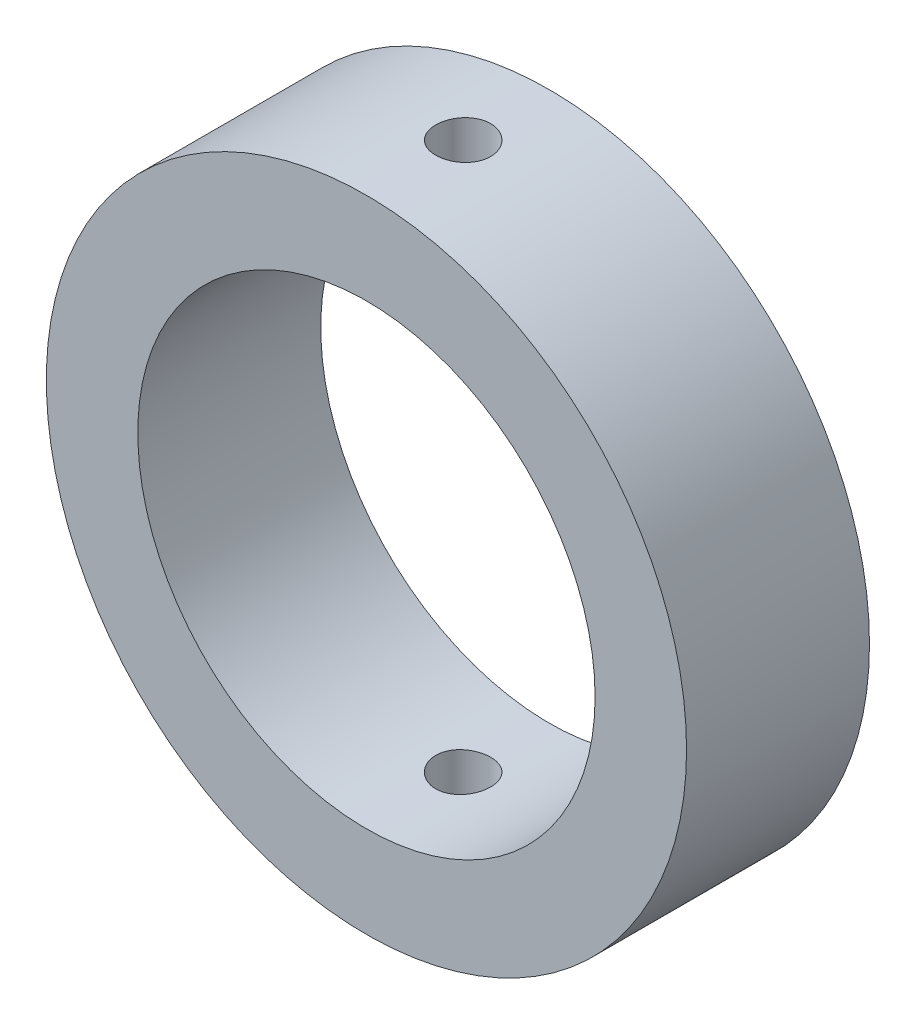
from build123d import *

# Parameters (mm, degrees)
SKETCH1_R               = 35
SKETCH1_R_2             = 25
BOSS_EXTRUDE1_DEPTH     = 20
CUT_EXTRUDE1_DEPTH      = 42
CUT_EXTRUDE1_DEPTH_BACK = 54.38539126
SKETCH2_R               = 3


with BuildPart() as part:
    # Sketch1 → Boss-Extrude1 (new body)
    with BuildSketch(Plane.XY):
        Circle(SKETCH1_R)
        Circle(SKETCH1_R_2, mode=Mode.SUBTRACT)
    extrude(amount=BOSS_EXTRUDE1_DEPTH)

    # Sketch2 → Cut-Extrude1 (cut, two sides: drawn at the far end of the back side and taken through both)
    with BuildSketch(Plane(origin=(0, 0, 0), x_dir=(1, 0, 0), z_dir=(0, 1, 0)).offset(-CUT_EXTRUDE1_DEPTH_BACK)):
        with Locations((0, -9.424155913)):
            Circle(SKETCH2_R)
    extrude(amount=CUT_EXTRUDE1_DEPTH + CUT_EXTRUDE1_DEPTH_BACK, mode=Mode.SUBTRACT)


solid = part.part
